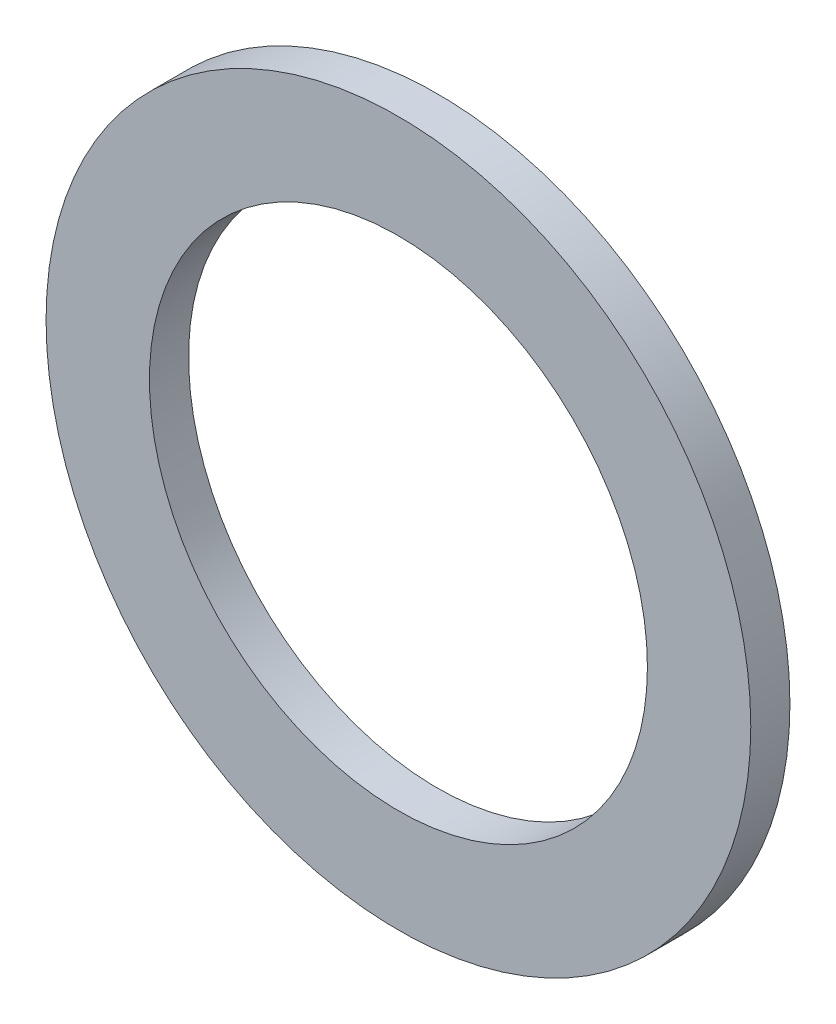
from build123d import *

# Parameters (mm, degrees)
SKETCH1_R           = 4.5
SKETCH1_R_2         = 3.18
BOSS_EXTRUDE1_DEPTH = 0.5


with BuildPart() as part:
    # Sketch1 → Boss-Extrude1 (new body)
    with BuildSketch(Plane.XY):
        Circle(SKETCH1_R)
        Circle(SKETCH1_R_2, mode=Mode.SUBTRACT)
    extrude(amount=BOSS_EXTRUDE1_DEPTH)


solid = part.part
